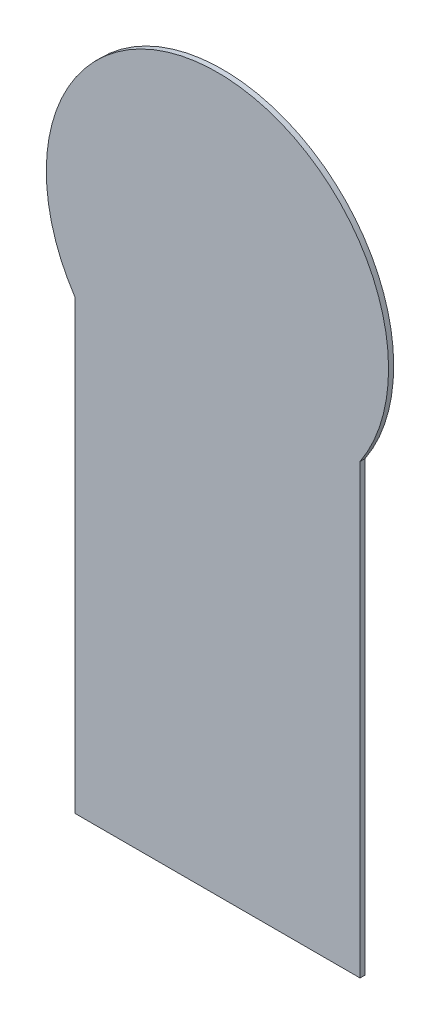
from build123d import *

# Parameters (mm, degrees)
BOSS_EXTRUDE1_DEPTH   = 0.1143
BOSS_EXTRUDE3_DEPTH   = 0.0508
BOSS_EXTRUDE3_2_DEPTH = 0.0508


with BuildPart() as part:
    # Sketch1 → Boss-Extrude1 (new body)
    with BuildSketch(Plane.XY):
        with BuildLine():
            Line((-3.175, -2.106056742), (-3.175, -12.065))
            Line((-3.175, -12.065), (3.175, -12.065))
            Line((3.175, -12.065), (3.175, -2.106056742))
            ThreePointArc((3.175, -2.106056742), (0, 3.81), (-3.175, -2.106056742))
        make_face()
    extrude(amount=BOSS_EXTRUDE1_DEPTH)


with BuildPart() as body_2:
    # Sketch2 → Boss-Extrude3 (new body)
    with BuildSketch(Plane(origin=(0, 0, 0), x_dir=(-1, 0, 0), z_dir=(0, 0, -1))):
        with BuildLine():
            Line((-2.034412002, -12.065), (-2.034412002, -3.013653991))
            ThreePointArc((-2.034412002, -3.013653991), (-2.090366562, -2.753017504), (-2.248369099, -2.538314245))
            ThreePointArc((-2.248369099, -2.538314245), (-3.38978212, 0.087063113), (-2.115102611, 2.650385586))
            ThreePointArc((-2.115102611, 2.650385586), (-2.012295955, 2.675910206), (-1.925900059, 2.614620208))
            Line((-1.925900059, 2.614620208), (-1.633518215, 2.1082))
            Line((-1.633518215, 2.1082), (1.50590086, 2.1082))
            ThreePointArc((1.50590086, 2.1082), (1.689889268, 1.963802154), (1.860105664, 1.8034))
            Line((1.860105664, 1.8034), (-1.964850488, 1.8034))
            ThreePointArc((-1.964850488, 1.8034), (-2.257411937, 1.420204333), (-2.476206906, 0.9906))
            Line((-2.476206906, 0.9906), (2.393941578, 0.9906))
            ThreePointArc((2.393941578, 0.9906), (2.450905617, 0.83982516), (2.498384078, 0.6858))
            Line((2.498384078, 0.6858), (-2.577317862, 0.6858))
            ThreePointArc((-2.577317862, 0.6858), (-2.651970456, 0.282739637), (-2.663974474, -0.127))
            Line((-2.663974474, -0.127), (2.587685383, -0.127))
            ThreePointArc((2.587685383, -0.127), (2.575637011, -0.279890387), (2.55456325, -0.4318))
            Line((2.55456325, -0.4318), (-2.631812638, -0.4318))
            ThreePointArc((-2.631812638, -0.4318), (-2.528175931, -0.849244052), (-2.358783551, -1.2446))
            Line((-2.358783551, -1.2446), (2.272270996, -1.2446))
            ThreePointArc((2.272270996, -1.2446), (2.179689938, -1.400427226), (2.07644029, -1.5494))
            Line((2.07644029, -1.5494), (-2.170771439, -1.5494))
            ThreePointArc((-2.170771439, -1.5494), (-1.877890411, -1.893783674), (-1.531050697, -2.183751992))
            ThreePointArc((-1.531050697, -2.183751992), (-1.332245968, -2.410653085), (-1.260586578, -2.703692942))
            Line((-1.260586578, -2.703692942), (-1.260586578, -3.147876155))
            Line((-1.260586578, -3.147876155), (-1.260586578, -4.387318627))
            ThreePointArc((-1.260586578, -4.387318627), (-1.252316574, -4.489468083), (-1.227721975, -4.588956826))
            Line((-1.227721975, -4.588956826), (-0.543276604, -6.632859168))
            ThreePointArc((-0.543276604, -6.632859168), (-0.518682005, -6.732347911), (-0.510412002, -6.834497367))
            Line((-0.510412002, -6.834497367), (-0.510412002, -12.065))
            Line((-0.510412002, -12.065), (-2.034412002, -12.065))
        make_face()
    extrude(amount=-BOSS_EXTRUDE3_DEPTH)


with BuildPart() as body_3:
    # Sketch2 → Boss-Extrude3 2 (new body)
    with BuildSketch(Plane(origin=(0, 0, 0), x_dir=(-1, 0, 0), z_dir=(0, 0, -1))):
        with BuildLine():
            Line((0.510412002, -12.065), (2.034412002, -12.065))
            Line((2.034412002, -12.065), (2.034412002, -3.013653991))
            ThreePointArc((2.034412002, -3.013653991), (2.090366562, -2.753017504), (2.248369099, -2.538314245))
            ThreePointArc((2.248369099, -2.538314245), (3.38978212, 0.087063113), (2.115102611, 2.650385586))
            ThreePointArc((2.115102611, 2.650385586), (2.012295955, 2.675910206), (1.925900059, 2.614620208))
            Line((1.925900059, 2.614620208), (1.687826002, 2.202263846))
            ThreePointArc((1.687826002, 2.202263846), (1.672731056, 2.116764971), (1.716092536, 2.041547307))
            ThreePointArc((1.716092536, 2.041547307), (1.958948732, 1.809809069), (2.170771439, 1.5494))
            Line((2.170771439, 1.5494), (-2.07644029, 1.5494))
            ThreePointArc((-2.07644029, 1.5494), (-2.179689938, 1.400427226), (-2.272270996, 1.2446))
            Line((-2.272270996, 1.2446), (2.358783551, 1.2446))
            ThreePointArc((2.358783551, 1.2446), (2.528175931, 0.849244052), (2.631812638, 0.4318))
            Line((2.631812638, 0.4318), (-2.55456325, 0.4318))
            ThreePointArc((-2.55456325, 0.4318), (-2.575637011, 0.279890387), (-2.587685383, 0.127))
            Line((-2.587685383, 0.127), (2.663974474, 0.127))
            ThreePointArc((2.663974474, 0.127), (2.651970456, -0.282739637), (2.577317862, -0.6858))
            Line((2.577317862, -0.6858), (-2.498384078, -0.6858))
            ThreePointArc((-2.498384078, -0.6858), (-2.450905617, -0.83982516), (-2.393941578, -0.9906))
            Line((-2.393941578, -0.9906), (2.476206906, -0.9906))
            ThreePointArc((2.476206906, -0.9906), (2.257411937, -1.420204333), (1.964850488, -1.8034))
            Line((1.964850488, -1.8034), (-1.860105664, -1.8034))
            ThreePointArc((-1.860105664, -1.8034), (-1.689889268, -1.963802154), (-1.50590086, -2.1082))
            Line((-1.50590086, -2.1082), (1.633518215, -2.1082))
            ThreePointArc((1.633518215, -2.1082), (1.582735331, -2.146587495), (1.531050697, -2.183751992))
            ThreePointArc((1.531050697, -2.183751992), (1.332245968, -2.410653085), (1.260586578, -2.703692942))
            Line((1.260586578, -2.703692942), (1.260586578, -3.147876155))
            Line((1.260586578, -3.147876155), (1.260586578, -4.387318627))
            ThreePointArc((1.260586578, -4.387318627), (1.252316574, -4.489468083), (1.227721975, -4.588956826))
            Line((1.227721975, -4.588956826), (0.543276604, -6.632859168))
            ThreePointArc((0.543276604, -6.632859168), (0.518682005, -6.732347911), (0.510412002, -6.834497367))
            Line((0.510412002, -6.834497367), (0.510412002, -12.065))
        make_face()
    extrude(amount=-BOSS_EXTRUDE3_2_DEPTH)


solid = Compound([part.part, body_2.part, body_3.part])
